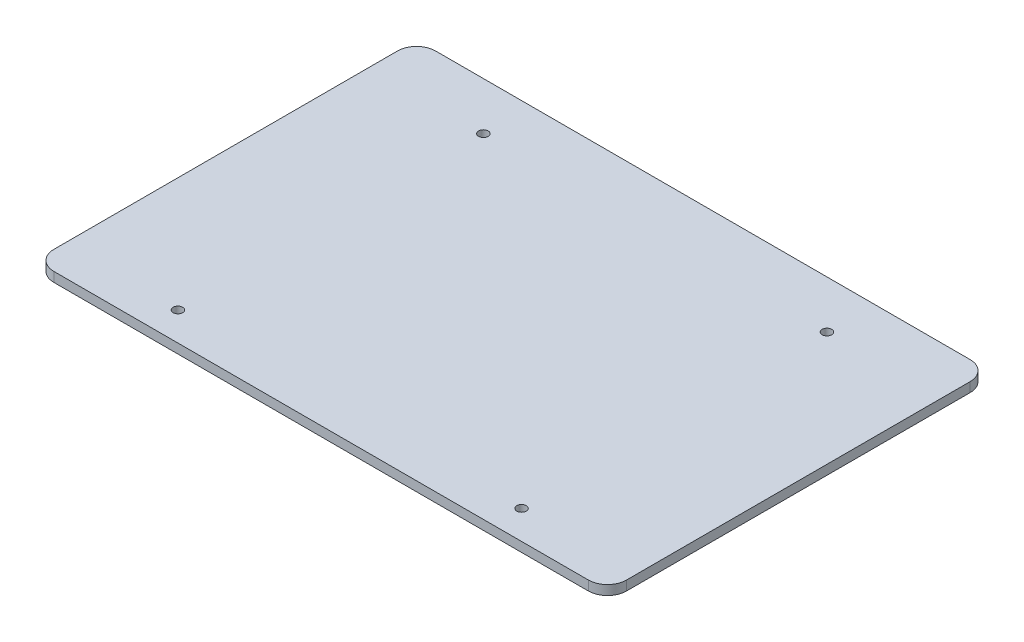
from build123d import *

# Parameters (mm, degrees)
SKETCH1_R           = 2.5
BOSS_EXTRUDE2_DEPTH = 5


with BuildPart() as part:
    # Sketch1 → Boss-Extrude2 (new body)
    with BuildSketch(Plane(origin=(0, 0, 0), x_dir=(1, 0, 0), z_dir=(0, 1, 0))):
        with BuildLine():
            Line((-140, -100), (140, -100))
            ThreePointArc((140, -100), (147.071067812, -97.071067812), (150, -90))
            Line((150, -90), (150, 90))
            ThreePointArc((150, 90), (147.071067812, 97.071067812), (140, 100))
            Line((140, 100), (-140, 100))
            ThreePointArc((-140, 100), (-147.071067812, 97.071067812), (-150, 90))
            Line((-150, 90), (-150, -90))
            ThreePointArc((-150, -90), (-147.071067812, -97.071067812), (-140, -100))
        make_face()
        with Locations(Location((-90, -85, 0), (0, 0, 270))):
            Circle(SKETCH1_R, mode=Mode.SUBTRACT)
        with Locations(Location((90, -85, 0), (0, 0, 270))):
            Circle(SKETCH1_R, mode=Mode.SUBTRACT)
        with Locations(Location((90, 75, 0), (0, 0, 270))):
            Circle(SKETCH1_R, mode=Mode.SUBTRACT)
        with Locations(Location((-90, 75, 0), (0, 0, 270))):
            Circle(SKETCH1_R, mode=Mode.SUBTRACT)
    extrude(amount=BOSS_EXTRUDE2_DEPTH)


solid = part.part
